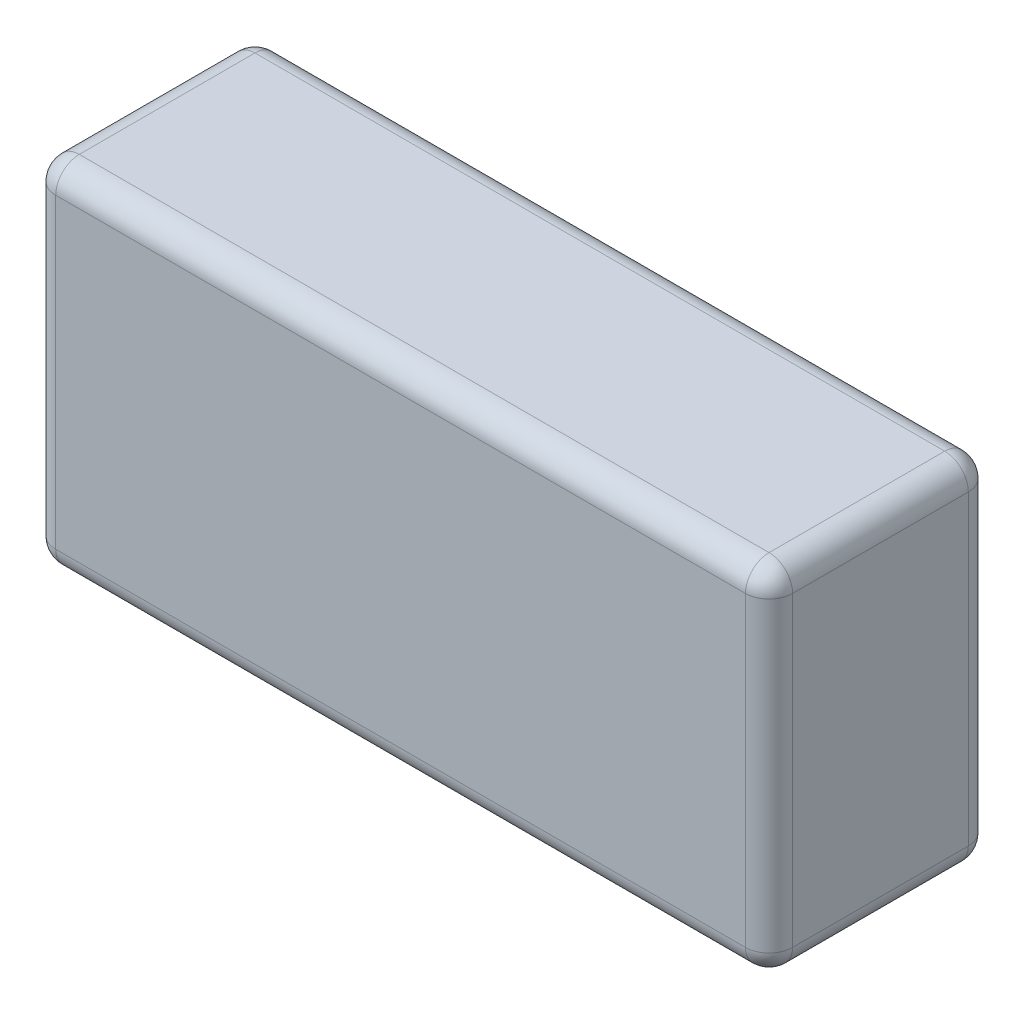
from build123d import *

# Parameters (mm, degrees)
SKETCH1_W           = 62.5
SKETCH1_H           = 30
BOSS_EXTRUDE1_DEPTH = 18.9
FILLET1_R           = 2


with BuildPart() as part:
    # Sketch1 → Boss-Extrude1 (new body)
    with BuildSketch(Plane.XY):
        with Locations((31.25, 15)):
            Rectangle(SKETCH1_W, SKETCH1_H)
    extrude(amount=BOSS_EXTRUDE1_DEPTH)

    # Fillet1
    fillet1_edges = [part.edges().sort_by_distance(p)[0] for p in [
        (62.5, 15, 18.9),
        (31.25, 30, 18.9),
        (0, 15, 18.9),
        (31.25, 30, 0),
        (62.5, 15, 0),
        (31.25, 0, 0),
        (0, 15, 0),
        (0, 30, 9.45),
        (62.5, 30, 9.45),
        (62.5, 0, 9.45),
        (0, 0, 9.45),
        (31.25, 0, 18.9),
    ]]
    fillet(fillet1_edges, radius=FILLET1_R)


solid = part.part
